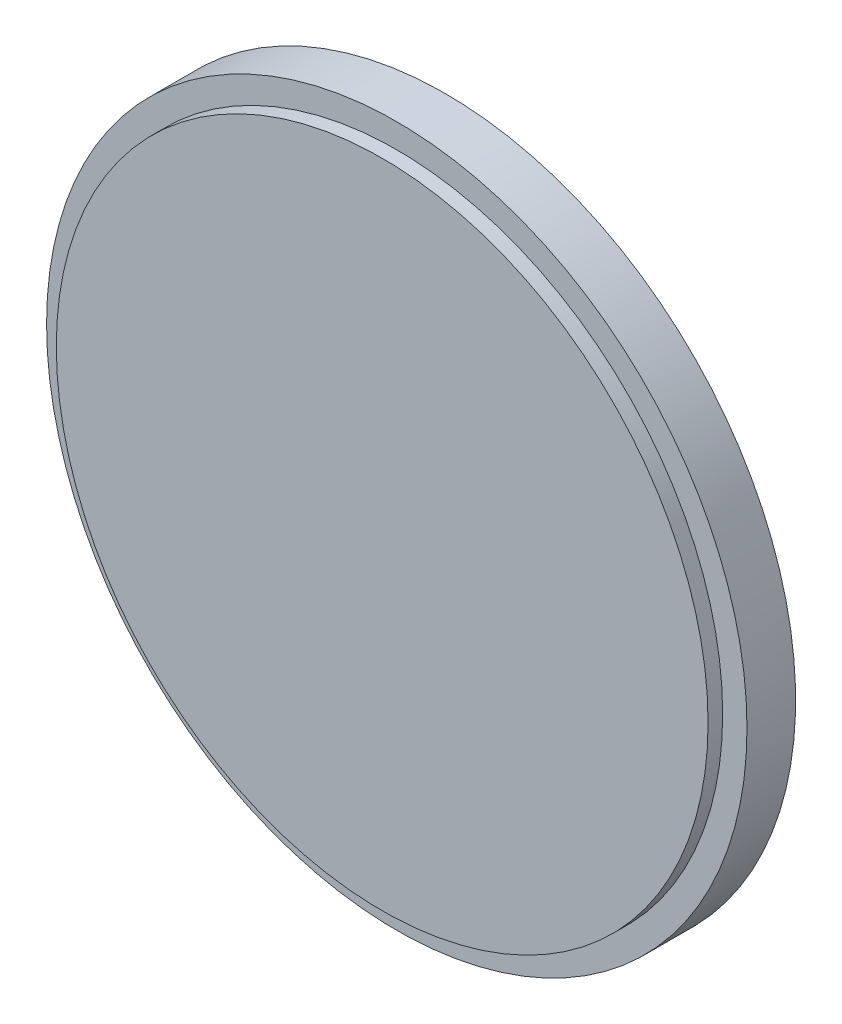
from build123d import *

# Parameters (mm, degrees)
ESBO_O1_R                     = 35
ESBO_O1_R_2                   = 32.5
RESSALTO_EXTRUS_O1_DEPTH      = 8
RESSALTO_EXTRUS_O2_START      = -3
ESBO_O2_R                     = 32.5
RESSALTO_EXTRUS_O2_DEPTH      = 3
ESBO_O3_R                     = 2.5
CORTE_EXTRUS_O1_DEPTH         = 3
RESSALTO_EXTRUS_O3_DEPTH      = 5
RESSALTO_EXTRUS_O3_DEPTH_BACK = 3
ESBO_O4_R                     = 37
ESBO_O4_R_2                   = 35
ESBO_O5_W                     = 1.8
ESBO_O5_H                     = 3
ESBO_O6_R                     = 12.55
RESSALTO_EXTRUS_O4_DEPTH      = 5
CORTE_EXTRUS_O2_DEPTH         = 53.933921071
CORTE_EXTRUS_O2_DEPTH_BACK    = 53.933921071
ESBO_O7_R                     = 7.55
RESSALTO_EXTRUS_O5_START      = -8
ESBO_O8_R                     = 37
ESBO_O8_R_2                   = 32.5
RESSALTO_EXTRUS_O5_DEPTH      = 8
ESBO_O9_R                     = 37
ESBO_O9_R_2                   = 33.5
CORTE_EXTRUS_O8_DEPTH         = 1.5
CORTE_EXTRUS_O9_START         = -1.5
ESBO_O12_R                    = 37
ESBO_O12_R_2                  = 33.5
CORTE_EXTRUS_O9_DEPTH         = 1.5
CORTE_EXTRUS_O10_START        = -10
ESBO_O13_R                    = 37
ESBO_O13_R_2                  = 36
CORTE_EXTRUS_O10_DEPTH        = 10
ESBO_O14_R                    = 37
ESBO_O14_R_2                  = 36
RESSALTO_EXTRUS_O6_DEPTH      = 5
ESBO_O15_R                    = 12.55
CORTE_EXTRUS_O11_DEPTH        = 53.933921071
ESBO_O16_R                    = 12.55
RESSALTO_EXTRUS_O7_DEPTH      = 3
ESBO_O17_R                    = 10
RESSALTO_EXTRUS_O8_DEPTH      = 16
ESBO_O18_R                    = 3.3
CORTE_EXTRUS_O12_DEPTH        = 16
ESBO_O19_W                    = 5.95
ESBO_O19_H                    = 2.65
CORTE_EXTRUS_O13_DEPTH        = 8
CORTE_EXTRUS_O14_DEPTH        = 58.265085349
CORTE_EXTRUS_O14_DEPTH_BACK   = 58.265085349
ESBO_O21_R                    = 1.65
ESBO_O23_R                    = 37
ESBO_O23_R_2                  = 36
CORTE_EXTRUS_O15_DEPTH        = 54.798234195


with BuildPart() as part:
    # Esboço1 → Ressalto-extrusão1 (new body)
    with BuildSketch(Plane.XY):
        Circle(ESBO_O1_R)
        Circle(ESBO_O1_R_2, mode=Mode.SUBTRACT)
    extrude(amount=RESSALTO_EXTRUS_O1_DEPTH)

    # Esboço2 → Ressalto-extrusão2 (add)
    with BuildSketch(Plane.XY.offset(8).offset(RESSALTO_EXTRUS_O2_START)):
        Circle(ESBO_O2_R)
    extrude(amount=RESSALTO_EXTRUS_O2_DEPTH)

    # Esboço3 → Corte-extrusão1 (cut)
    with BuildSketch(Plane.XY.offset(8)):
        Circle(ESBO_O3_R)
    extrude(amount=-CORTE_EXTRUS_O1_DEPTH, mode=Mode.SUBTRACT)

    # Esboço4 → Ressalto-extrusão3 (add, two sides: drawn at the far end of the back side and taken through both)
    with BuildSketch(Plane(origin=(0, 0, 5), x_dir=(-1, 0, 0), z_dir=(0, 0, -1)).offset(-RESSALTO_EXTRUS_O3_DEPTH_BACK)):
        Circle(ESBO_O4_R)
        Circle(ESBO_O4_R_2, mode=Mode.SUBTRACT)
    extrude(amount=RESSALTO_EXTRUS_O3_DEPTH + RESSALTO_EXTRUS_O3_DEPTH_BACK)

    # Esboço5 → Corte-Revolução1 (revolve, cut)
    with BuildSketch(Plane(origin=(0, 0, 0), x_dir=(1, 0, 0), z_dir=(0, 1, 0))):
        with Locations((-36.1, -2.5)):
            Rectangle(ESBO_O5_W, ESBO_O5_H)
        with Locations((-36.1, -5.5)):
            Rectangle(ESBO_O5_W, ESBO_O5_H)
    revolve(axis=Axis((0, 0, 8), (0, 0, -1)), mode=Mode.SUBTRACT)

    # Esboço6 → Ressalto-extrusão4 (add)
    with BuildSketch(Plane(origin=(0, 0, 5), x_dir=(-1, 0, 0), z_dir=(0, 0, -1))):
        with Locations(Location((0, 0, 0), (0, 0, 180))):
            Circle(ESBO_O6_R)
    extrude(amount=RESSALTO_EXTRUS_O4_DEPTH)

    # Esboço7 → Corte-extrusão2 (cut, two sides: drawn at the far end of the back side and taken through both)
    with BuildSketch(Plane(origin=(0, 0, 0), x_dir=(-1, 0, 0), z_dir=(0, 0, -1)).offset(-CORTE_EXTRUS_O2_DEPTH_BACK)):
        Circle(ESBO_O7_R)
    extrude(amount=CORTE_EXTRUS_O2_DEPTH + CORTE_EXTRUS_O2_DEPTH_BACK, mode=Mode.SUBTRACT)

    # Esboço8 → Ressalto-extrusão5 (add)
    with BuildSketch(Plane.XY.offset(8).offset(RESSALTO_EXTRUS_O5_START)):
        with Locations(Location((0, 0, 0), (0, 0, 180))):
            Circle(ESBO_O8_R)
        Circle(ESBO_O8_R_2, mode=Mode.SUBTRACT)
    extrude(amount=RESSALTO_EXTRUS_O5_DEPTH)

    # Esboço9 → Corte-extrusão8 (cut)
    with BuildSketch(Plane.XY.offset(8)):
        with Locations(Location((0, 0, 0), (0, 0, 180))):
            Circle(ESBO_O9_R)
        Circle(ESBO_O9_R_2, mode=Mode.SUBTRACT)
    extrude(amount=-CORTE_EXTRUS_O8_DEPTH, mode=Mode.SUBTRACT)

    # Esboço12 → Corte-extrusão9 (cut)
    with BuildSketch(Plane(origin=(0, 0, 0), x_dir=(-1, 0, 0), z_dir=(0, 0, -1)).offset(CORTE_EXTRUS_O9_START)):
        Circle(ESBO_O12_R)
        with Locations(Location((0, 0, 0), (0, 0, 180))):
            Circle(ESBO_O12_R_2, mode=Mode.SUBTRACT)
    extrude(amount=CORTE_EXTRUS_O9_DEPTH, mode=Mode.SUBTRACT)

    # Esboço13 → Corte-extrusão10 (cut)
    with BuildSketch(Plane(origin=(0, 0, 1.5), x_dir=(-1, 0, 0), z_dir=(0, 0, -1)).offset(CORTE_EXTRUS_O10_START)):
        Circle(ESBO_O13_R)
        Circle(ESBO_O13_R_2, mode=Mode.SUBTRACT)
    extrude(amount=CORTE_EXTRUS_O10_DEPTH, mode=Mode.SUBTRACT)

    # Esboço14 → Ressalto-extrusão6 (add)
    with BuildSketch(Plane.XY.offset(6.5)):
        Circle(ESBO_O14_R)
        Circle(ESBO_O14_R_2, mode=Mode.SUBTRACT)
    extrude(amount=-RESSALTO_EXTRUS_O6_DEPTH)

    # Esboço15 → Corte-extrusão11 (cut, through all)
    with BuildSketch(Plane(origin=(0, 0, 0), x_dir=(-1, 0, 0), z_dir=(0, 0, -1))):
        Circle(ESBO_O15_R)
    extrude(amount=-CORTE_EXTRUS_O11_DEPTH, mode=Mode.SUBTRACT)

    # Esboço16 → Ressalto-extrusão7 (add, through all)
    with BuildSketch(Plane(origin=(0, 0, 5), x_dir=(-1, 0, 0), z_dir=(0, 0, -1))):
        Circle(ESBO_O16_R)
    extrude(amount=-RESSALTO_EXTRUS_O7_DEPTH)

    # Esboço17 → Ressalto-extrusão8 (add)
    with BuildSketch(Plane(origin=(0, 0, 5), x_dir=(-1, 0, 0), z_dir=(0, 0, -1))):
        with Locations(Location((0, 0, 0), (0, 0, 180))):
            Circle(ESBO_O17_R)
    extrude(amount=RESSALTO_EXTRUS_O8_DEPTH)

    # Esboço18 → Corte-extrusão12 (cut)
    with BuildSketch(Plane(origin=(0, 0, -11), x_dir=(-1, 0, 0), z_dir=(0, 0, -1))):
        Circle(ESBO_O18_R)
    extrude(amount=-CORTE_EXTRUS_O12_DEPTH, mode=Mode.SUBTRACT)

    # Esboço19 → Corte-extrusão13 (cut)
    with BuildSketch(Plane(origin=(0, 0, -11), x_dir=(-1, 0, 0), z_dir=(0, 0, -1))):
        with Locations((0, -6.625)):
            Rectangle(ESBO_O19_W, ESBO_O19_H)
        with Locations((0, 6.625)):
            Rectangle(ESBO_O19_W, ESBO_O19_H)
    extrude(amount=-CORTE_EXTRUS_O13_DEPTH, mode=Mode.SUBTRACT)

    # Esboço21 → Corte-extrusão14 (cut, two sides: drawn at the far end of the back side and taken through both)
    with BuildSketch(Plane(origin=(0, 5.3, 0), x_dir=(1, 0, 0), z_dir=(0, 1, 0)).offset(-CORTE_EXTRUS_O14_DEPTH_BACK)):
        with Locations(Location((0, 6.85, 0), (0, 0, 180))):
            Circle(ESBO_O21_R)
    extrude(amount=CORTE_EXTRUS_O14_DEPTH + CORTE_EXTRUS_O14_DEPTH_BACK, mode=Mode.SUBTRACT)

    # Esboço23 → Corte-extrusão15 (cut, through all)
    with BuildSketch(Plane(origin=(0, 0, 1.5), x_dir=(-1, 0, 0), z_dir=(0, 0, -1))):
        Circle(ESBO_O23_R)
        Circle(ESBO_O23_R_2, mode=Mode.SUBTRACT)
    extrude(amount=-CORTE_EXTRUS_O15_DEPTH, mode=Mode.SUBTRACT)


solid = part.part
